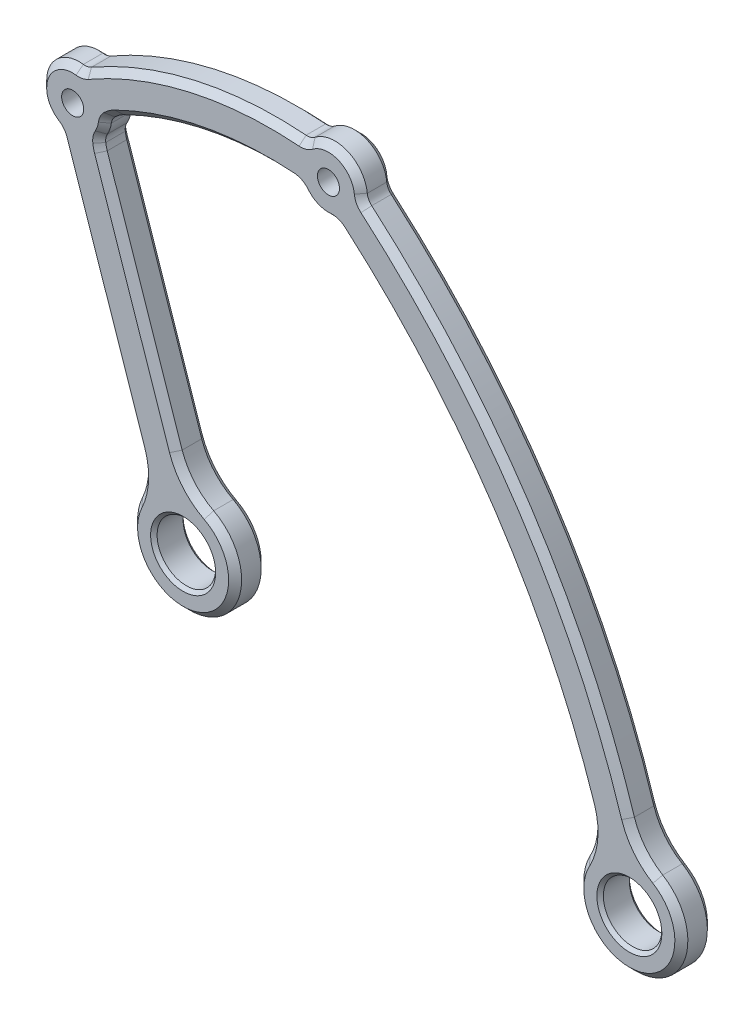
from build123d import *

# Parameters (mm, degrees)
SKETCH_2_R         = 1
SKETCH_2_R_2       = 4.5
EXTRUDE_1_DEPTH    = 5
HOLE_WIZARD_M3_1_D = 3.4
EXTRUDE_START      = -5
SKETCH_5_R         = 5
SKETCH_5_R_2       = 1.7
EXTRUDE_2_DEPTH    = 5
FILLET_1_R         = 2
CHAMFER_1_SIZE     = 1
CHAMFER_2_SIZE     = 0.5


with BuildPart() as part:
    # ｽｹｯﾁ2 → ﾎﾞｽ - 押し出し1 (new body)
    with BuildSketch(Plane.XY):
        with BuildLine():
            Line((-103.472140065, 101.974881276), (-90.465628325, 63.493979587))
            ThreePointArc((-90.465628325, 63.493979587), (-89.954765024, 59.732746642), (-90.882432701, 56.052082673))
            ThreePointArc((-90.882432701, 56.052082673), (-81.075459946, 45.081398796), (-79.93528971, 59.752207608))
            ThreePointArc((-79.93528971, 59.752207608), (-82.905745012, 62.115309356), (-84.781534849, 65.415198302))
            Line((-84.781534849, 65.415198302), (-96.306113117, 99.511670303))
            ThreePointArc((-96.306113117, 99.511670303), (-96.187159058, 103.029978486), (-93.779139917, 105.597873802))
            ThreePointArc((-93.779139917, 105.597873802), (-80.151317429, 110.147426191), (-65.802869152, 110.880914253))
            ThreePointArc((-65.802869152, 110.880914253), (-62.79775687, 110.146159795), (-60.161017961, 108.5280832))
            ThreePointArc((-60.161017961, 108.5280832), (-36.743622956, 82.25702049), (-21.311725155, 50.627925419))
            ThreePointArc((-21.311725155, 50.627925419), (-20.854856748, 46.607677814), (-22.028392426, 42.735477722))
            ThreePointArc((-22.028392426, 42.735477722), (-12.907537143, 31.192758259), (-10.862618787, 45.76130941))
            ThreePointArc((-10.862618787, 45.76130941), (-13.545428623, 48.130915345), (-15.221875918, 51.293513228))
            ThreePointArc((-15.221875918, 51.293513228), (-31.975045673, 85.917727287), (-57.825293588, 114.400521723))
            ThreePointArc((-57.825293588, 114.400521723), (-60.237672636, 115.875551965), (-62.966502646, 116.616344549))
            ThreePointArc((-62.966502646, 116.616344549), (-63.790868965, 116.712759854), (-64.616469843, 116.797959214))
            ThreePointArc((-64.616469843, 116.797959214), (-83.805953805, 115.41075886), (-101.461958411, 107.767060739))
            ThreePointArc((-101.461958411, 107.767060739), (-103.459014377, 105.2152335), (-103.472140065, 101.974881276))
        make_face()
        with Locations((-100.624843057, 104.231631526)):
            Circle(SKETCH_2_R, mode=Mode.SUBTRACT)
        with Locations((-61.284609553, 113.347883242)):
            Circle(SKETCH_2_R, mode=Mode.SUBTRACT)
        with Locations((-83.637084901, 52.660190097)):
            Circle(SKETCH_2_R_2, mode=Mode.SUBTRACT)
        with Locations((-15, 38.914260651)):
            Circle(SKETCH_2_R_2, mode=Mode.SUBTRACT)
    extrude(amount=EXTRUDE_1_DEPTH)

    # M3 すきま穴1 (through all)
    with Locations(Plane.XY.offset(5)):
        with Locations((-100.624843057, 104.231631526), (-61.284609553, 113.347883242)):
            Hole(HOLE_WIZARD_M3_1_D / 2)

    # ｽｹｯﾁ5 → ﾎﾞｽ - 押し出し2 (add)
    # profile 1 of 2: a face of its own
    with BuildSketch(Plane.XY.offset(5).offset(EXTRUDE_START)):
        with Locations((-61.284609553, 113.347883242)):
            Circle(SKETCH_5_R)
        with Locations((-61.284609553, 113.347883242)):
            Circle(SKETCH_5_R_2, mode=Mode.SUBTRACT)
    # profile 2 of 2: a face of its own
    with BuildSketch(Plane.XY.offset(5).offset(EXTRUDE_START)):
        with Locations((-100.624843057, 104.231631526)):
            Circle(SKETCH_5_R)
        with Locations((-100.624843057, 104.231631526)):
            Circle(SKETCH_5_R_2, mode=Mode.SUBTRACT)
    extrude(amount=EXTRUDE_2_DEPTH)

    # ﾌｨﾚｯﾄ1
    fillet_1_edges = [part.edges().sort_by_distance(p)[0] for p in [
        (-65.624090381, 110.864154969, 2.5),
        (-60.112946246, 108.487100888, 2.5),
        (-64.879819417, 116.822716479, 2.5),
        (-99.362317161, 109.06960924, 2.5),
        (-102.696867003, 99.681168168, 2.5),
        (-95.62884168, 104.031705929, 2.5),
        (-96.565369931, 101.312611496, 2.5),
        (-56.290152028, 113.11252386, 2.5),
    ]]
    fillet(fillet_1_edges, radius=FILLET_1_R)

    # 面取り1
    chamfer_1_edges = [part.edges().sort_by_distance(p)[0] for p in [
        (-63.254449444, 108.752262413, 0),
        (-63.254449444, 108.752262413, 5),
        (-36.468601994, 81.845427724, 5),
        (-36.468601994, 81.845427724, 0),
        (-82.784185615, 115.651324671, 0),
        (-82.784185615, 115.651324671, 5),
        (-59.311410558, 117.942062791, 0),
        (-59.311410558, 117.942062791, 5),
        (-105.33131857, 105.919555769, 0),
        (-105.33131857, 105.919555769, 5),
        (-96.455977383, 81.216950803, 5),
        (-96.455977383, 81.216950803, 0),
        (-95.897394141, 102.603372718, 5),
        (-95.897394141, 102.603372718, 0),
        (-94.487289761, 105.172948924, 5),
        (-94.487289761, 105.172948924, 0),
        (-12.907537142, 31.192758259, 0),
        (-65.803719474, 110.720207394, 5),
        (-65.803719474, 110.720207394, 0),
        (-60.09675649, 108.271617943, 0),
        (-60.09675649, 108.271617943, 5),
        (-64.991188093, 116.971232495, 0),
        (-64.991188093, 116.971232495, 5),
        (-20.854856748, 46.607677814, 0),
        (-99.334511967, 109.21169773, 5),
        (-99.334511967, 109.21169773, 0),
        (-102.771580483, 99.539211795, 0),
        (-102.771580483, 99.539211795, 5),
        (-96.508212123, 101.154703384, 5),
        (-96.508212123, 101.154703384, 0),
        (-95.486566991, 104.120924199, 0),
        (-95.486566991, 104.120924199, 5),
        (-56.094530779, 113.134481641, 5),
        (-56.094530779, 113.134481641, 0),
        (-80.538181989, 110.0728847, 0),
        (-96.44619913, 100.009724643, 0),
        (-90.543823983, 82.463434303, 0),
        (-82.905745012, 62.115309356, 0),
        (-81.075459946, 45.081398796, 0),
        (-89.954765024, 59.732746642, 0),
        (-31.176585427, 84.721278475, 0),
        (-13.545428623, 48.130915345, 0),
        (-89.954765024, 59.732746642, 5),
        (-81.075459946, 45.081398796, 5),
        (-82.905745012, 62.115309356, 5),
        (-90.543823983, 82.463434303, 5),
        (-96.44619913, 100.009724643, 5),
        (-13.545428623, 48.130915345, 5),
        (-80.538181989, 110.0728847, 5),
        (-20.854856748, 46.607677814, 5),
        (-12.907537142, 31.192758259, 5),
        (-31.176585427, 84.721278475, 5),
    ]]
    chamfer(chamfer_1_edges, length=CHAMFER_1_SIZE)

    # 面取り2
    chamfer_2_edges = [part.edges().sort_by_distance(p)[0] for p in [
        (-88.137084901, 52.660190097, 0),
        (-88.137084901, 52.660190097, 5),
        (-19.5, 38.914260651, 0),
        (-19.5, 38.914260651, 5),
    ]]
    chamfer(chamfer_2_edges, length=CHAMFER_2_SIZE)


solid = part.part
